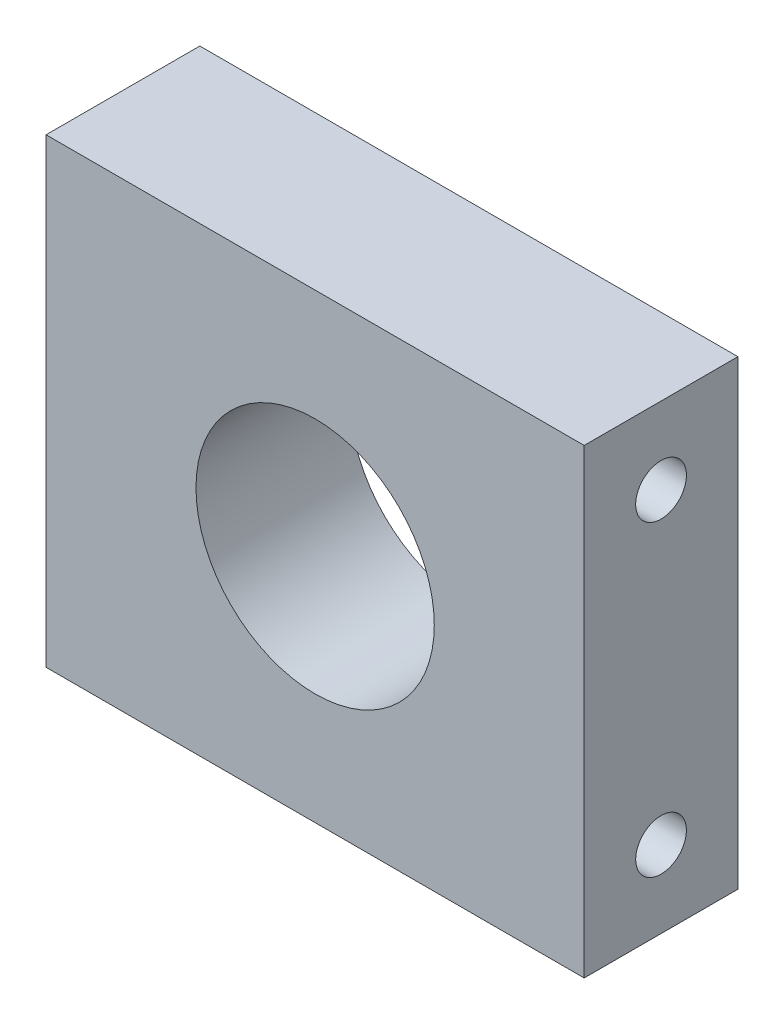
from build123d import *

# Parameters (mm, degrees)
SKETCH1_W           = 35
SKETCH1_H           = 30
BOSS_EXTRUDE1_DEPTH = 10
SKETCH2_R           = 7.75
CUT_EXTRUDE1_DEPTH  = 10
SKETCH3_R           = 1.65
CUT_EXTRUDE2_DEPTH  = 10


with BuildPart() as part:
    # Sketch1 → Boss-Extrude1 (new body)
    with BuildSketch(Plane.XY):
        Rectangle(SKETCH1_W, SKETCH1_H)
    extrude(amount=BOSS_EXTRUDE1_DEPTH)

    # Sketch2 → Cut-Extrude1 (cut)
    with BuildSketch(Plane.XY.offset(10)):
        Circle(SKETCH2_R)
    extrude(amount=-CUT_EXTRUDE1_DEPTH, mode=Mode.SUBTRACT)

    # Sketch3 → Cut-Extrude2 (cut)
    with BuildSketch(Plane(origin=(17.5, 0, 0), x_dir=(0, 0, -1), z_dir=(1, 0, 0))):
        with Locations((-5, 10)):
            Circle(SKETCH3_R)
        with Locations(Location((-5, -10, 0), (0, 0, 180))):
            Circle(SKETCH3_R)
    cut_extrude2 = extrude(amount=-CUT_EXTRUDE2_DEPTH, mode=Mode.SUBTRACT)

    # Mirror1: Cut-Extrude2 across plane
    add(cut_extrude2.mirror(Plane(origin=(0, 0, 0), x_dir=(0, 0, 1), z_dir=(1, 0, 0))), mode=Mode.SUBTRACT)


solid = part.part
